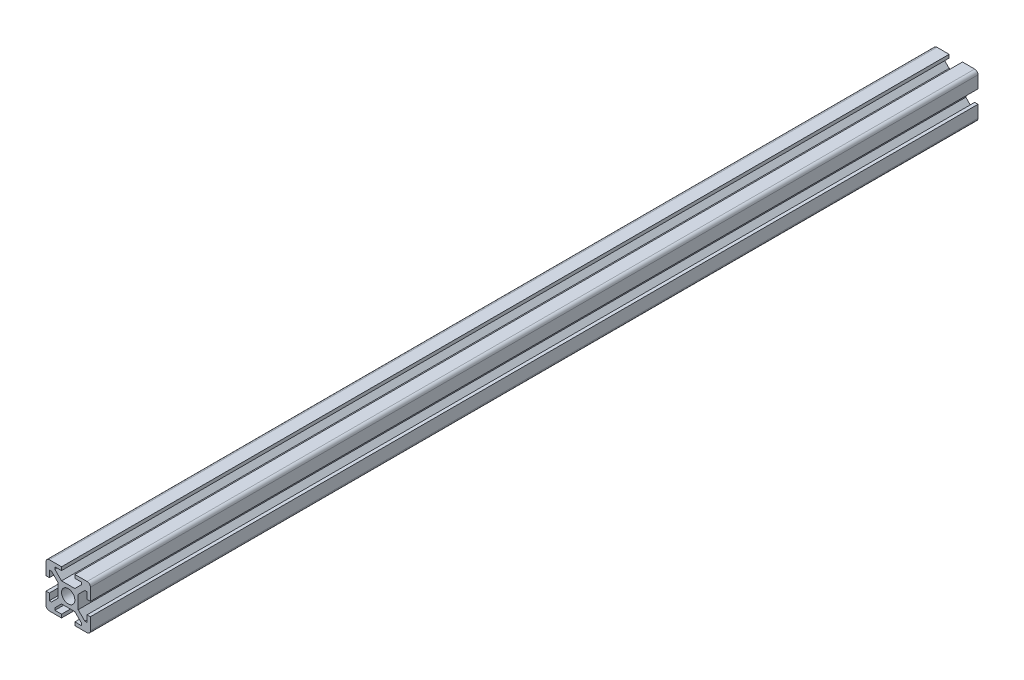
from build123d import *

# Parameters (mm, degrees)
ESQUISSE1_W                  = 20
ESQUISSE1_H                  = 20
EXTRUSION1_DEPTH             = 200
CONG_1_R                     = 1.5
ENL_V_MAT_EXTRU_1_DEPTH      = 401.249921924
R_P_TITION_CIRCULAIRE1_COUNT = 4


with BuildPart() as part:
    # Esquisse1 → Extrusion1 (new, symmetric)
    with BuildSketch(Plane.XY):
        Rectangle(ESQUISSE1_W, ESQUISSE1_H)
    extrude(amount=EXTRUSION1_DEPTH, both=True)

    # Congé1
    cong_1_edges = [part.edges().sort_by_distance(p)[0] for p in [
        (-10, -10, 0),
        (10, -10, 0),
        (-10, 10, 0),
        (10, 10, 0),
    ]]
    fillet(cong_1_edges, radius=CONG_1_R)

    # Esquisse2 → Enlèv. mat.-Extru.1 (cut, through all)
    with BuildSketch(Plane(origin=(0, 0, -200), x_dir=(-1, 0, 0), z_dir=(0, 0, -1))):
        Polygon((-10, 3), (-10, -3), (-8.5, -3), (-8.5, -6), (-7.5, -6), (-4.5, -3), (-4.5, 3), (-7.5, 6), (-8.5, 6), (-8.5, 3), align=None)
    enl_v_mat_extru_1 = extrude(amount=-ENL_V_MAT_EXTRU_1_DEPTH, mode=Mode.SUBTRACT)

    # Répétition circulaire1: Enlèv. mat.-Extru.1 ×4 about axis
    r_p_tition_circulaire1_axis = Axis((0, 0, 9.333809512), (0, 0, -1))
    for i in range(1, R_P_TITION_CIRCULAIRE1_COUNT):
        add(enl_v_mat_extru_1.rotate(r_p_tition_circulaire1_axis, i * 360 / R_P_TITION_CIRCULAIRE1_COUNT), mode=Mode.SUBTRACT)

    # Esquisse5 → Trou taraudé M6x1.01 (revolve, cut)
    with BuildSketch(Plane(origin=(0, 0, -200), x_dir=(0, 1, 0), z_dir=(1, 0, 0))):
        Polygon((0, 0), (0, 31.502151548), (2.5, 30), (2.5, 24), (3, 24), (3, 0), align=None)
    trou_taraud_m6x1_01 = revolve(axis=Axis((0, 0, -206.35), (0, 0, 1)), mode=Mode.SUBTRACT)

    # Symétrie1: Trou taraudé M6x1.01 across plane
    add(trou_taraud_m6x1_01.mirror(Plane.XY), mode=Mode.SUBTRACT)


solid = part.part
